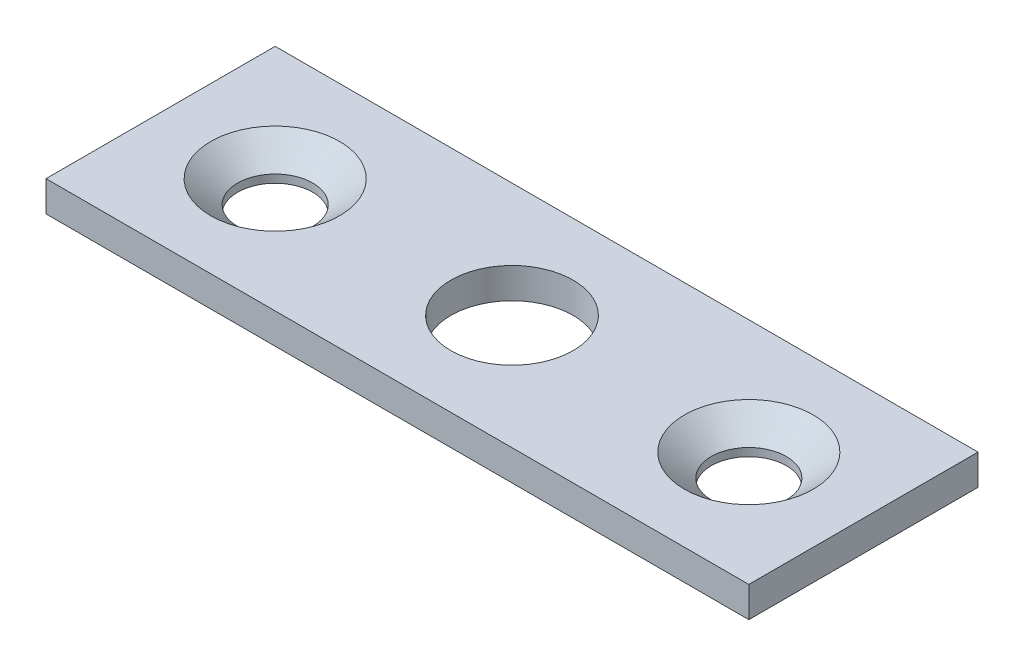
from build123d import *

# Parameters (mm, degrees)
SKETCH1_W                                         = 46
SKETCH1_H                                         = 15
SKETCH1_R                                         = 4
BOSS_EXTRUDE1_DEPTH                               = 2
CSK_FOR_8_FLAT_HEAD_MACHINE_SCREW_100_D           = 4.9149
CSK_FOR_8_FLAT_HEAD_MACHINE_SCREW_100_DEPTH       = 25
CSK_FOR_8_FLAT_HEAD_MACHINE_SCREW_100_CSINK_D     = 8.4328
CSK_FOR_8_FLAT_HEAD_MACHINE_SCREW_100_CSINK_ANGLE = 100
CSK_FOR_8_FLAT_HEAD_MACHINE_SCREW_100_TIP         = 1.476584928


with BuildPart() as part:
    # Sketch1 → Boss-Extrude1 (new body)
    with BuildSketch(Plane(origin=(0, 0, 0), x_dir=(1, 0, 0), z_dir=(0, 1, 0))):
        Rectangle(SKETCH1_W, SKETCH1_H)
        with Locations(Location((0, 0, 0), (0, 0, 270))):
            Circle(SKETCH1_R, mode=Mode.SUBTRACT)
    extrude(amount=BOSS_EXTRUDE1_DEPTH)

    # CSK for #8 Flat Head Machine Screw (100)1
    with Locations(Plane(origin=(0, 2, 0), x_dir=(1, 0, 0), z_dir=(0, 1, 0))):
        with Locations((-15.5, 0), (15.5, 0)):
            CounterSinkHole(CSK_FOR_8_FLAT_HEAD_MACHINE_SCREW_100_D / 2, CSK_FOR_8_FLAT_HEAD_MACHINE_SCREW_100_CSINK_D / 2, depth=CSK_FOR_8_FLAT_HEAD_MACHINE_SCREW_100_DEPTH, counter_sink_angle=CSK_FOR_8_FLAT_HEAD_MACHINE_SCREW_100_CSINK_ANGLE)
            with Locations((0, 0, -(CSK_FOR_8_FLAT_HEAD_MACHINE_SCREW_100_DEPTH + CSK_FOR_8_FLAT_HEAD_MACHINE_SCREW_100_TIP / 2))):  # 118° drill point
                Cone(0, CSK_FOR_8_FLAT_HEAD_MACHINE_SCREW_100_D / 2, CSK_FOR_8_FLAT_HEAD_MACHINE_SCREW_100_TIP, mode=Mode.SUBTRACT)


solid = part.part
